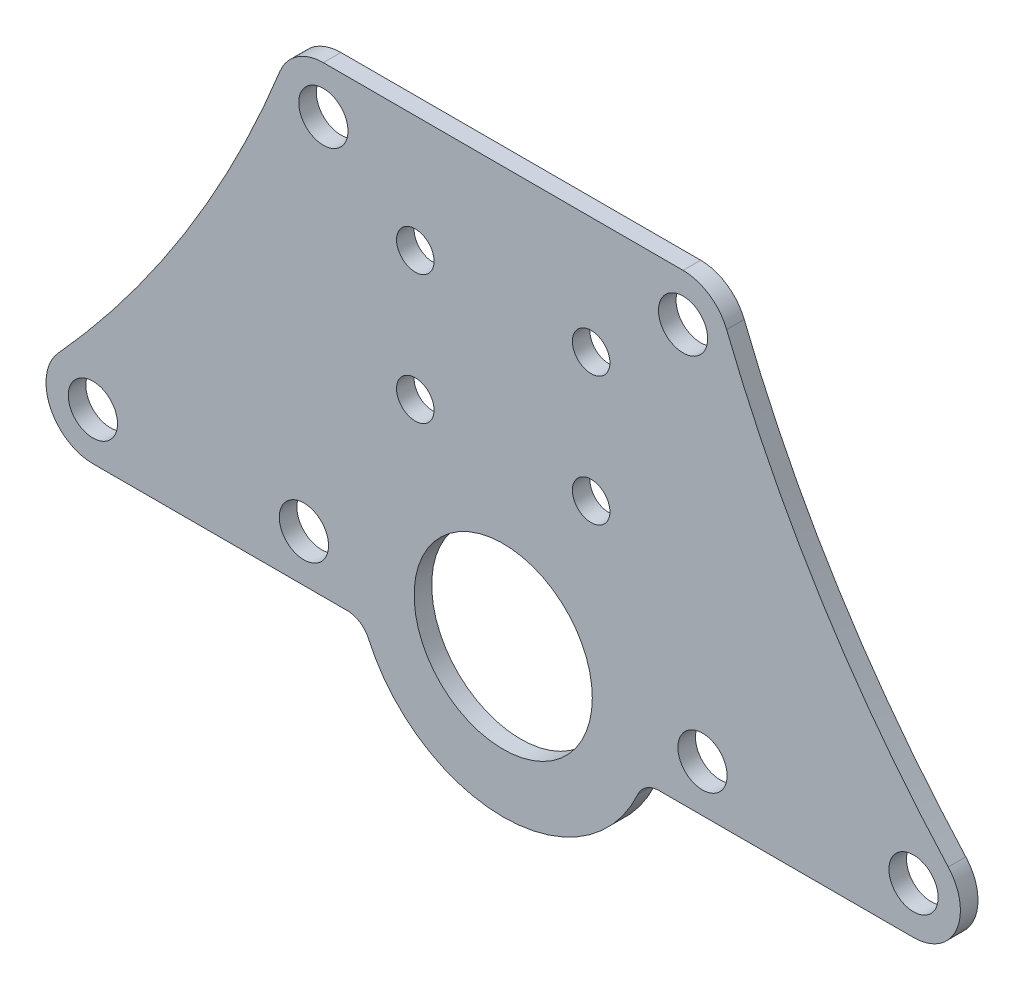
from build123d import *

# Parameters (mm, degrees)
SKETCH_1_R      = 7.6
SKETCH_1_R_2    = 2.1
SKETCH_1_R_3    = 1.6
EXTRUDE_1_DEPTH = 1.5
FILLET_2_R      = 2


with BuildPart() as part:
    # ｽｹｯﾁ1 → ﾎﾞｽ - 押し出し1 (new body)
    with BuildSketch(Plane.XY):
        with BuildLine():
            ThreePointArc((-37.95979357, -17.309345429), (-38.658047176, -21.61823696), (-35, -24))
            Line((-35, -24), (-11.948221625, -24))
            ThreePointArc((-11.948221625, -24), (0, -32.6), (11.948221625, -24))
            Line((11.948221625, -24), (35, -24))
            ThreePointArc((35, -24), (38.658047176, -21.61823696), (37.95979357, -17.309345429))
            ThreePointArc((37.95979357, -17.309345429), (27.149823207, -3.034907568), (19.058822549, 12.938531129))
            ThreePointArc((19.058822549, 12.938531129), (17.587655142, 14.768604061), (15.342990138, 15.45779162))
            Line((15.342990138, 15.45779162), (-15.342990138, 15.45779162))
            ThreePointArc((-15.342990138, 15.45779162), (-17.587655142, 14.768604061), (-19.058822549, 12.938531129))
            ThreePointArc((-19.058822549, 12.938531129), (-27.149823207, -3.034907568), (-37.95979357, -17.309345429))
        make_face()
        with Locations((0, -20)):
            Circle(SKETCH_1_R, mode=Mode.SUBTRACT)
        with Locations((-35, -20)):
            Circle(SKETCH_1_R_2, mode=Mode.SUBTRACT)
        with Locations((-17, -20)):
            Circle(SKETCH_1_R_2, mode=Mode.SUBTRACT)
        with Locations((-7.5, -5.5)):
            Circle(SKETCH_1_R_3, mode=Mode.SUBTRACT)
        with Locations((17, -20)):
            Circle(SKETCH_1_R_2, mode=Mode.SUBTRACT)
        with Locations((35, -20)):
            Circle(SKETCH_1_R_2, mode=Mode.SUBTRACT)
        with Locations((7.5, -5.5)):
            Circle(SKETCH_1_R_3, mode=Mode.SUBTRACT)
        with Locations((-7.5, 5.5)):
            Circle(SKETCH_1_R_3, mode=Mode.SUBTRACT)
        with Locations((-15.342990138, 11.45779162)):
            Circle(SKETCH_1_R_2, mode=Mode.SUBTRACT)
        with Locations((7.5, 5.5)):
            Circle(SKETCH_1_R_3, mode=Mode.SUBTRACT)
        with Locations((15.342990138, 11.45779162)):
            Circle(SKETCH_1_R_2, mode=Mode.SUBTRACT)
    extrude(amount=EXTRUDE_1_DEPTH)

    # ﾌｨﾚｯﾄ2
    fillet_2_edges = [part.edges().sort_by_distance(p)[0] for p in [
        (-11.948221625, -24, 0.75),
        (11.948221625, -24, 0.75),
    ]]
    fillet(fillet_2_edges, radius=FILLET_2_R)


solid = part.part
